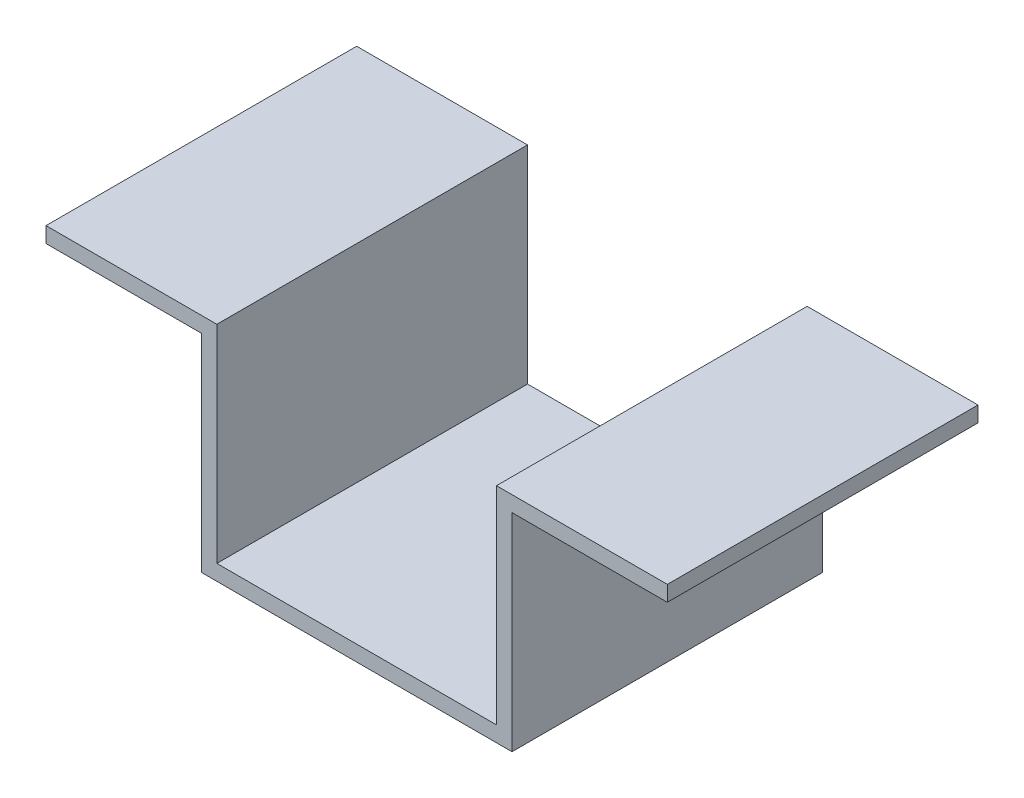
from build123d import *

# Parameters (mm, degrees)
EXTRUDE_1_DEPTH = 30


with BuildPart() as part:
    # 草图1 → 凸台-拉伸1 (new body)
    with BuildSketch(Plane.XY):
        Polygon((-30, 10), (-15, 10), (-15, -10), (0, -10), (15, -10), (15, 10), (30, 10), (30, 11.5), (13.5, 11.5), (13.5, -8.5), (0, -8.5), (-13.5, -8.5), (-13.5, 11.5), (-30, 11.5), align=None)
    extrude(amount=EXTRUDE_1_DEPTH)


solid = part.part
